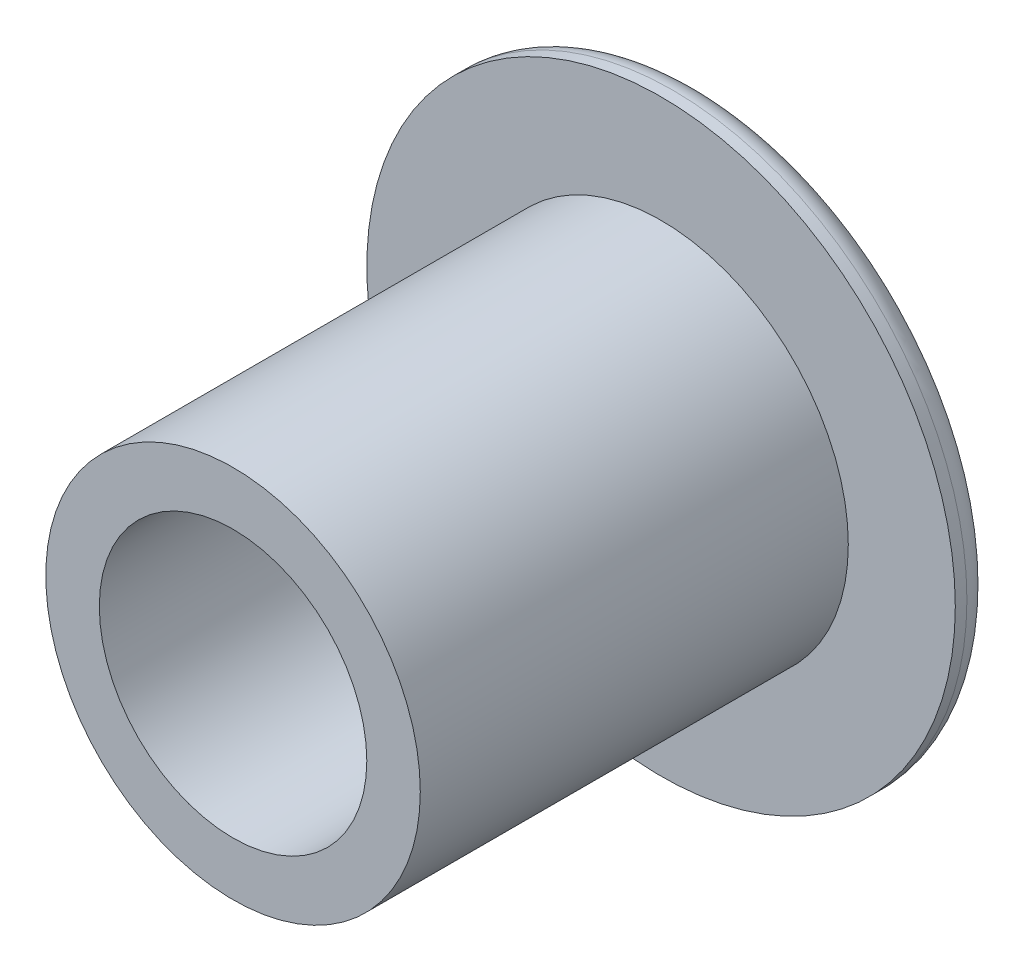
from build123d import *

# Parameters (mm, degrees)
FILLET1_R = 0.5


with BuildPart() as part:
    # Sketch2 → Revolve1 (revolve)
    with BuildSketch(Plane(origin=(0, 0, 0), x_dir=(1, 0, 0), z_dir=(0, 1, 0))):
        Polygon((2.5, 0), (3.5, 0), (3.5, 8), (5.5, 8), (5.5, 8.5), (3, 10), (2.5, 10), align=None)
    revolve(axis=Axis((0, 0, 0), (0, 0, -1)))

    # Fillet1
    fillet1_edges = [part.edges().sort_by_distance(p)[0] for p in [
        (-5.5, 0, -8.5),
        (-3, 0, -10),
    ]]
    fillet(fillet1_edges, radius=FILLET1_R)


with BuildPart() as body_2:
    # Sketch4 → Revolve2 (revolve)
    with BuildSketch(Plane(origin=(0, 0, 0), x_dir=(1, 0, 0), z_dir=(0, 1, 0)), mode=Mode.PRIVATE) as revolve2_sk:
        with BuildLine():
            Line((0, 7.781542094), (2.5, 7.781542094))
            ThreePointArc((2.5, 7.781542094), (1.767766953, 9.549309047), (0, 10.281542094))
            Line((0, 10.281542094), (0, 7.781542094))
        make_face()
    revolve(revolve2_sk.sketch.rotate(Axis((0, 0, -10.281542094), (0, 0, 1)), 180), axis=Axis((0, 0, -10.281542094), (0, 0, 1)))


solid = Compound([part.part, body_2.part])
